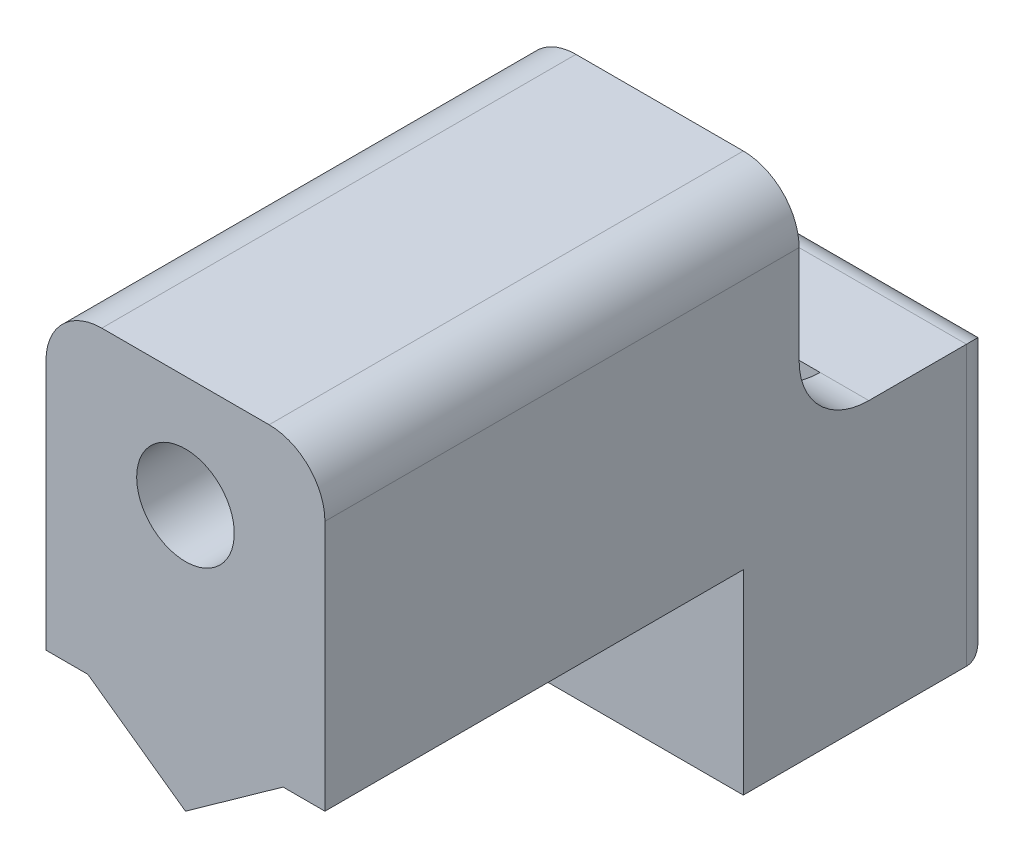
from build123d import *

# Parameters (mm, degrees)
EXTRUDE_1_DEPTH     = 7
SKETCH_6_R          = 1.5
CUT_EXTRUDE_1_DEPTH = 11.934463864
CUT_EXTRUDE_2_DEPTH = 3
EXTRUDE_3_DEPTH     = 7
SKETCH_10_W         = 10
SKETCH_10_H         = 7
EXTRUDE_4_DEPTH     = 7
SKETCH_12_W         = 3.25
SKETCH_12_H         = 1.314739763
SKETCH_12_H_2       = 1.185260237
CUT_EXTRUDE_3_DEPTH = 7
CUT_EXTRUDE_4_DEPTH = 6.2
FILLET_1_R          = 2.5
FILLET_2_R          = 1
FILLET_4_R          = 2
EXTRUDE_START       = 10
SKETCH_14_R         = 1.5
EXTRUDE_5_DEPTH     = 10
SKETCH_15_W         = 10
SKETCH_15_H         = 7
EXTRUDE_6_DEPTH     = 2
CUT_EXTRUDE_5_DEPTH = 10
CUT_EXTRUDE_6_DEPTH = 10
SKETCH_19_R         = 1.75
CUT_EXTRUDE_7_DEPTH = 21.989580749


with BuildPart() as part:
    # Эскиз3 → Бобышка-Вытянуть1 (new body)
    with BuildSketch(Plane.XY):
        Polygon((0, -6.75), (-3.5, -4.25), (-5, -4.25), (-5, 4.75), (-5, 6.75), (5, 6.75), (5, -4.25), (3.5, -4.25), align=None)
    extrude(amount=EXTRUDE_1_DEPTH)

    # Эскиз6 → Вырез-Вытянуть1 (cut, through all)
    with BuildSketch(Plane(origin=(0, 0, 0), x_dir=(-1, 0, 0), z_dir=(0, 0, -1))):
        with Locations((0, 2.75)):
            Circle(SKETCH_6_R)
    extrude(amount=-CUT_EXTRUDE_1_DEPTH, mode=Mode.SUBTRACT)

    # Эскиз7 → Вырез-Вытянуть2 (cut)
    with BuildSketch(Plane(origin=(0, 0, 0), x_dir=(-1, 0, 0), z_dir=(0, 0, -1))):
        Polygon((1.58771324, 0), (3.175426481, 2.75), (1.58771324, 5.5), (-1.58771324, 5.5), (-3.175426481, 2.75), (-1.58771324, 0), align=None)
    extrude(amount=-CUT_EXTRUDE_2_DEPTH, mode=Mode.SUBTRACT)

    # Эскиз8 → Бобышка-Вытянуть3 (add)
    with BuildSketch(Plane(origin=(0, 0, 0), x_dir=(-1, 0, 0), z_dir=(0, 0, -1))):
        Polygon((-5, -1.25), (-5, -4.25), (-3.5, -4.25), (3.5, -4.25), (5, -4.25), (5, -1.25), align=None)
    extrude(amount=EXTRUDE_3_DEPTH)

    # Эскиз10 → Бобышка-Вытянуть4 (add)
    with BuildSketch(Plane.XZ.offset(4.25)):
        with Locations((0, -3.5)):
            Rectangle(SKETCH_10_W, SKETCH_10_H)
    extrude(amount=EXTRUDE_4_DEPTH)

    # Эскиз12 → Вырез-Вытянуть3 (cut)
    with BuildSketch(Plane(origin=(0, 0, -7), x_dir=(-1, 0, 0), z_dir=(0, 0, -1))):
        with Locations((-1.625, -5.592630119)):
            Rectangle(SKETCH_12_W, SKETCH_12_H)
        with Locations((1.625, -5.592630119)):
            Rectangle(SKETCH_12_W, SKETCH_12_H)
        with Locations((1.625, -6.842630119)):
            Rectangle(SKETCH_12_W, SKETCH_12_H_2)
        with Locations((-1.625, -6.842630119)):
            Rectangle(SKETCH_12_W, SKETCH_12_H_2)
    extrude(amount=-CUT_EXTRUDE_3_DEPTH, mode=Mode.SUBTRACT)

    # Эскиз13 → Вырез-Вытянуть4 (cut)
    with BuildSketch(Plane(origin=(0, -1.25, 0), x_dir=(1, 0, 0), z_dir=(0, 1, 0))):
        Polygon((0, 0), (3.25, 0), (3.25, 2.5), (-3.25, 2.5), (-3.25, 0), align=None)
    extrude(amount=-CUT_EXTRUDE_4_DEPTH, mode=Mode.SUBTRACT)

    # Скругление1
    fillet_1_edges = [part.edges().sort_by_distance(p)[0] for p in [
        (4.125, -1.25, 0),
        (-4.125, -1.25, 0),
    ]]
    fillet(fillet_1_edges, radius=FILLET_1_R)

    # Скругление2
    fillet_2_edges = [part.edges().sort_by_distance(p)[0] for p in [
        (0, -11.25, -7),
        (5, -6.25, -7),
        (-5, -6.25, -7),
        (0, -1.25, -7),
    ]]
    fillet(fillet_2_edges, radius=FILLET_2_R)

    # Скругление4
    fillet_4_edges = [part.edges().sort_by_distance(p)[0] for p in [
        (5, 6.75, 3.5),
        (-5, 6.75, 3.5),
    ]]
    fillet(fillet_4_edges, radius=FILLET_4_R)

    # Эскиз14 → Бобышка-Вытянуть5 (add)
    with BuildSketch(Plane.XY.offset(7).offset(EXTRUDE_START)):
        with BuildLine():
            Line((3.5, -4.25), (5, -4.25))
            Line((5, -4.25), (5, 4.75))
            ThreePointArc((5, 4.75), (4.414213562, 6.164213562), (3, 6.75))
            Line((3, 6.75), (-3, 6.75))
            ThreePointArc((-3, 6.75), (-4.414213562, 6.164213562), (-5, 4.75))
            Line((-5, 4.75), (-5, -4.25))
            Line((-5, -4.25), (-3.5, -4.25))
            Line((-3.5, -4.25), (0, -6.75))
            Line((0, -6.75), (3.5, -4.25))
        make_face()
        with Locations(Location((0, 2.75, 0), (0, 0, 180))):
            Circle(SKETCH_14_R, mode=Mode.SUBTRACT)
    extrude(amount=-EXTRUDE_5_DEPTH)

    # Эскиз15 → Бобышка-Вытянуть6 (add)
    with BuildSketch(Plane.XY):
        with Locations((0, -7.75)):
            Rectangle(SKETCH_15_W, SKETCH_15_H)
    extrude(amount=EXTRUDE_6_DEPTH)

    # Эскиз17 → Вырез-Вытянуть5 (cut)
    with BuildSketch(Plane(origin=(0, 0, 0), x_dir=(-1, 0, 0), z_dir=(0, 0, -1))):
        Polygon((1.58771324, 0), (3.175426481, 2.75), (1.58771324, 5.5), (-1.58771324, 5.5), (-3.175426481, 2.75), (-1.58771324, 0), align=None)
    extrude(amount=-CUT_EXTRUDE_5_DEPTH, mode=Mode.SUBTRACT)

    # Эскиз18 → Вырез-Вытянуть6 (cut)
    with BuildSketch(Plane(origin=(0, 0, 0), x_dir=(-1, 0, 0), z_dir=(0, 0, -1))):
        Polygon((1.645448267, -0.1), (3.290896534, 2.75), (1.645448267, 5.6), (-1.645448267, 5.6), (-3.290896534, 2.75), (-1.645448267, -0.1), align=None)
    extrude(amount=-CUT_EXTRUDE_6_DEPTH, mode=Mode.SUBTRACT)

    # Эскиз19 → Вырез-Вытянуть7 (cut, through all)
    with BuildSketch(Plane(origin=(0, 0, 10), x_dir=(-1, 0, 0), z_dir=(0, 0, -1))):
        with Locations((0, 2.75)):
            Circle(SKETCH_19_R)
    extrude(amount=-CUT_EXTRUDE_7_DEPTH, mode=Mode.SUBTRACT)


solid = part.part
